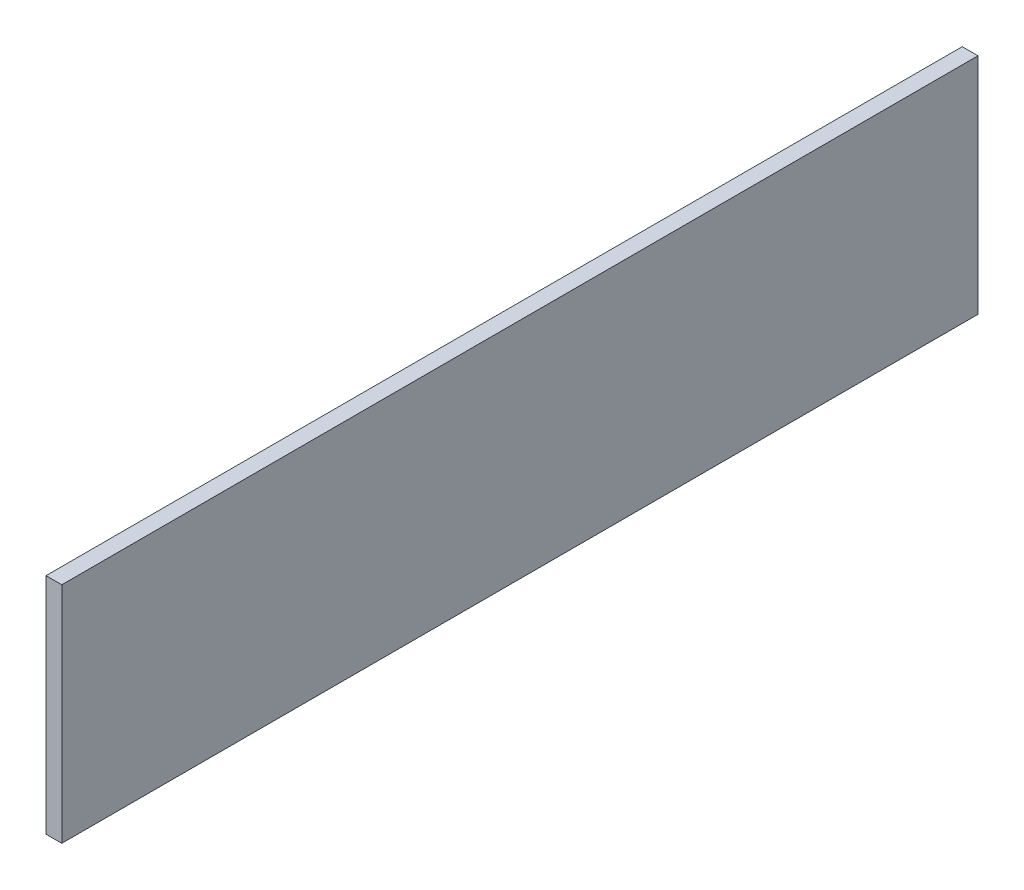
from build123d import *

# Parameters (mm, degrees)
CROQUIS1_W              = 290.5
CROQUIS1_H              = 71
SALIENTE_EXTRUIR1_DEPTH = 5


with BuildPart() as part:
    # Croquis1 → Saliente-Extruir1 (new body)
    with BuildSketch(Plane(origin=(0, 0, 0), x_dir=(0, 0, -1), z_dir=(1, 0, 0))):
        with Locations((103.02124183, 9.281045752)):
            Rectangle(CROQUIS1_W, CROQUIS1_H)
    extrude(amount=SALIENTE_EXTRUIR1_DEPTH)


solid = part.part
